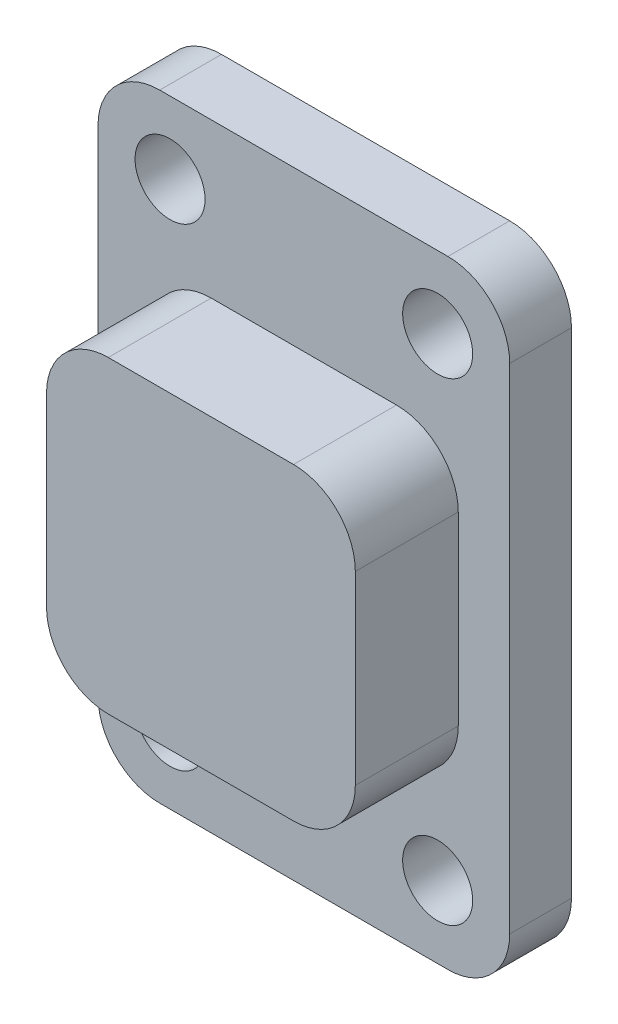
from build123d import *

# Parameters (mm, degrees)
SKETCH1_W                  = 20
SKETCH1_H                  = 30
BOSS_EXTRUDE1_DEPTH        = 3
F_3_4_3_4_DIAMETER_HOLE1_D = 3.4
SKETCH5_R                  = 3.4
CUT_EXTRUDE1_DEPTH         = 0.5
FILLET1_R                  = 3
SKETCH7_W                  = 8
SKETCH7_H                  = 15
BOSS_EXTRUDE3_DEPTH        = 11
CUT_EXTRUDE3_DEPTH         = 25.839484697
CUT_EXTRUDE3_DEPTH_BACK    = 25.839484697
SKETCH11_OUTSIDE_W         = 29.736
SKETCH11_OUTSIDE_H         = 39.736
SKETCH11_OUTSIDE_R         = 2.5
CUT_EXTRUDE4_DEPTH         = 22.118712082
SKETCH12_W                 = 7.43023475
SKETCH12_H                 = 21.108621448
CUT_EXTRUDE5_DEPTH         = 29.653097564
SKETCH13_R                 = 3.4
SKETCH13_R_2               = 2.75
BOSS_EXTRUDE4_DEPTH        = 0.5
SKETCH14_W                 = 15
SKETCH14_H                 = 15
BOSS_EXTRUDE5_DEPTH        = 5
FILLET2_R                  = 3


with BuildPart() as part:
    # Sketch1 → Boss-Extrude1 (new body)
    with BuildSketch(Plane.XY):
        Rectangle(SKETCH1_W, SKETCH1_H)
    extrude(amount=BOSS_EXTRUDE1_DEPTH)

    # Ø3.4 (3.4) Diameter Hole1 (through all)
    with Locations(Plane.XY.offset(3)):
        with Locations((-6.5, 11.5), (6.5, 11.5), (6.5, -11.5), (-6.5, -11.5)):
            Hole(F_3_4_3_4_DIAMETER_HOLE1_D / 2)

    # Sketch5 → Cut-Extrude1 (cut)
    with BuildSketch(Plane(origin=(0, 0, 0), x_dir=(-1, 0, 0), z_dir=(0, 0, -1))):
        Circle(SKETCH5_R)
    extrude(amount=-CUT_EXTRUDE1_DEPTH, mode=Mode.SUBTRACT)

    # Fillet1
    fillet1_edges = [part.edges().sort_by_distance(p)[0] for p in [
        (10, -15, 1.5),
        (-10, -15, 1.5),
        (-10, 15, 1.5),
        (10, 15, 1.5),
    ]]
    fillet(fillet1_edges, radius=FILLET1_R)

    # Sketch7 → Boss-Extrude3 (add)
    with BuildSketch(Plane.XY.offset(3)):
        Rectangle(SKETCH7_W, SKETCH7_H)
    extrude(amount=BOSS_EXTRUDE3_DEPTH)

    # Sketch8 → Cut-Extrude3 (cut, two sides: drawn at the far end of the back side and taken through both)
    with BuildSketch(Plane(origin=(4, 0, 0), x_dir=(0, 0, -1), z_dir=(1, 0, 0)).offset(-CUT_EXTRUDE3_DEPTH_BACK)):
        Polygon((-14, -6), (-14, -7), (-13.133974596, -6.5), align=None)
        Polygon((-13.133974596, -7.5), (-14, -7), (-14, -7.5), align=None)
        Polygon((-14, -5), (-14, -6), (-13.133974596, -5.5), align=None)
        Polygon((-14, -4), (-14, -5), (-13.133974596, -4.5), align=None)
        Polygon((-14, -3), (-14, -4), (-13.133974596, -3.5), align=None)
        Polygon((-14, 7), (-13.133974596, 7.5), (-14, 7.5), align=None)
        Polygon((-14, -2), (-14, -3), (-13.133974596, -2.5), align=None)
        Polygon((-13.133974596, 6.5), (-14, 7), (-14, 6), align=None)
        Polygon((-14, -1), (-14, -2), (-13.133974596, -1.5), align=None)
        Polygon((-13.133974596, 5.5), (-14, 6), (-14, 5), align=None)
        Polygon((-14, 0), (-14, -1), (-13.133974596, -0.5), align=None)
        Polygon((-13.133974596, 4.5), (-14, 5), (-14, 4), align=None)
        Polygon((-14, 1), (-14, 0), (-13.133974596, 0.5), align=None)
        Polygon((-13.133974596, 3.5), (-14, 4), (-14, 3), align=None)
        Polygon((-14, 2), (-14, 1), (-13.133974596, 1.5), align=None)
        Polygon((-13.133974596, 2.5), (-14, 3), (-14, 2), align=None)
    extrude(amount=CUT_EXTRUDE3_DEPTH + CUT_EXTRUDE3_DEPTH_BACK, mode=Mode.SUBTRACT)

    # Sketch11 outside → Cut-Extrude4 (cut, through all)
    with BuildSketch(Plane.XY.offset(3)):
        Rectangle(SKETCH11_OUTSIDE_W, SKETCH11_OUTSIDE_H)
        Circle(SKETCH11_OUTSIDE_R, mode=Mode.SUBTRACT)
    extrude(amount=CUT_EXTRUDE4_DEPTH, mode=Mode.SUBTRACT)

    # Sketch12 → Cut-Extrude5 (cut, through all)
    with BuildSketch(Plane(origin=(10, 0, 0), x_dir=(0, 0, -1), z_dir=(1, 0, 0))):
        with Locations((-11.715117375, -0.112579314)):
            Rectangle(SKETCH12_W, SKETCH12_H)
    extrude(amount=-CUT_EXTRUDE5_DEPTH, mode=Mode.SUBTRACT)

    # Sketch13 → Boss-Extrude4 (add)
    with BuildSketch(Plane(origin=(0, 0, 0), x_dir=(-1, 0, 0), z_dir=(0, 0, -1))):
        Circle(SKETCH13_R)
        Circle(SKETCH13_R_2, mode=Mode.SUBTRACT)
    extrude(amount=-BOSS_EXTRUDE4_DEPTH)

    # Sketch14 → Boss-Extrude5 (add)
    with BuildSketch(Plane.XY.offset(3)):
        Rectangle(SKETCH14_W, SKETCH14_H)
    extrude(amount=BOSS_EXTRUDE5_DEPTH)

    # Fillet2
    fillet2_edges = [part.edges().sort_by_distance(p)[0] for p in [
        (7.5, 7.5, 5.5),
        (7.5, -7.5, 5.5),
        (-7.5, -7.5, 5.5),
        (-7.5, 7.5, 5.5),
    ]]
    fillet(fillet2_edges, radius=FILLET2_R)


solid = part.part
